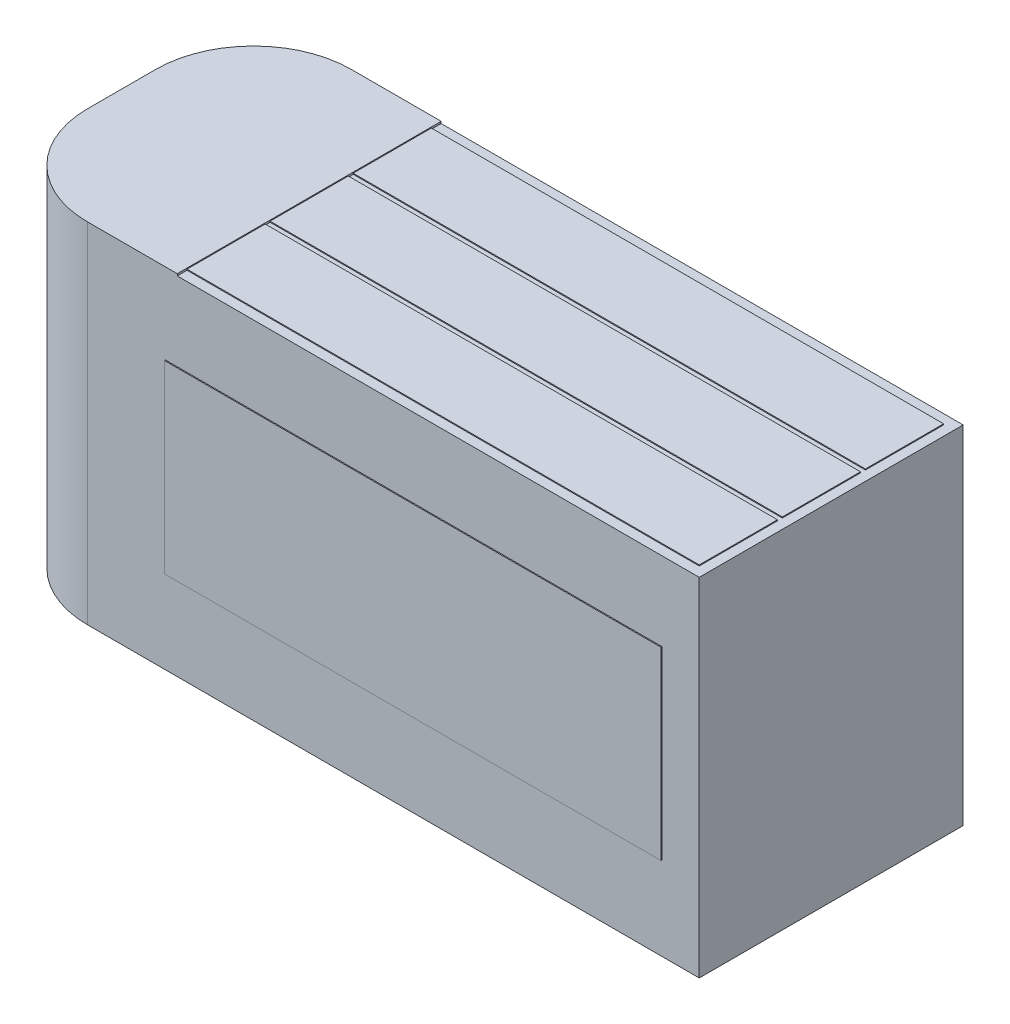
from build123d import *

# Parameters (mm, degrees)
SKETCH1_W           = 72.6
SKETCH1_H           = 35.5
BOSS_EXTRUDE1_DEPTH = 27
FILLET1_R           = 10
SKETCH2_W           = 52.4
SKETCH2_H           = 8
BOSS_EXTRUDE2_DEPTH = 0.1
SKETCH3_W           = 50.8
SKETCH3_H           = 18.9
BOSS_EXTRUDE3_DEPTH = 0.1
BOSS_EXTRUDE4_DEPTH = 0.2
SKETCH5_W           = 53.5
SKETCH5_H           = 19.7
BOSS_EXTRUDE5_DEPTH = 0.1


with BuildPart() as part:
    # Sketch1 → Boss-Extrude1 (new body)
    with BuildSketch(Plane.XY):
        Rectangle(SKETCH1_W, SKETCH1_H)
    extrude(amount=BOSS_EXTRUDE1_DEPTH)

    # Fillet1
    fillet1_edges = [part.edges().sort_by_distance(p)[0] for p in [
        (-36.3, 0, 27),
        (-36.3, 0, 0),
    ]]
    fillet(fillet1_edges, radius=FILLET1_R)

    # Sketch2 → Boss-Extrude2 (add)
    with BuildSketch(Plane(origin=(0, 17.75, 0), x_dir=(1, 0, 0), z_dir=(0, 1, 0))):
        with Locations((9.1, -5)):
            Rectangle(SKETCH2_W, SKETCH2_H)
        with Locations((9.1, -13.5)):
            Rectangle(SKETCH2_W, SKETCH2_H)
        with Locations((9.1, -22)):
            Rectangle(SKETCH2_W, SKETCH2_H)
    extrude(amount=BOSS_EXTRUDE2_DEPTH)

    # Sketch3 → Boss-Extrude3 (add)
    with BuildSketch(Plane.XY.offset(27)):
        with Locations((7.1, 0.25)):
            Rectangle(SKETCH3_W, SKETCH3_H)
    extrude(amount=BOSS_EXTRUDE3_DEPTH)

    # Sketch4 → Boss-Extrude4 (add)
    with BuildSketch(Plane(origin=(0, 17.75, 0), x_dir=(1, 0, 0), z_dir=(0, 1, 0))):
        with BuildLine():
            Line((-26.3, 0), (-17.1, 0))
            Line((-17.1, 0), (-17.1, -27))
            Line((-17.1, -27), (-26.3, -27))
            ThreePointArc((-26.3, -27), (-33.371067812, -24.071067812), (-36.3, -17))
            Line((-36.3, -17), (-36.3, -10))
            ThreePointArc((-36.3, -10), (-33.371067812, -2.928932188), (-26.3, 0))
        make_face()
    extrude(amount=BOSS_EXTRUDE4_DEPTH)

    # Sketch5 → Boss-Extrude5 (add)
    with BuildSketch(Plane(origin=(0, 0, 0), x_dir=(-1, 0, 0), z_dir=(0, 0, -1))):
        with Locations((-6.524728086, 1.45)):
            Rectangle(SKETCH5_W, SKETCH5_H)
    extrude(amount=BOSS_EXTRUDE5_DEPTH)


solid = part.part
